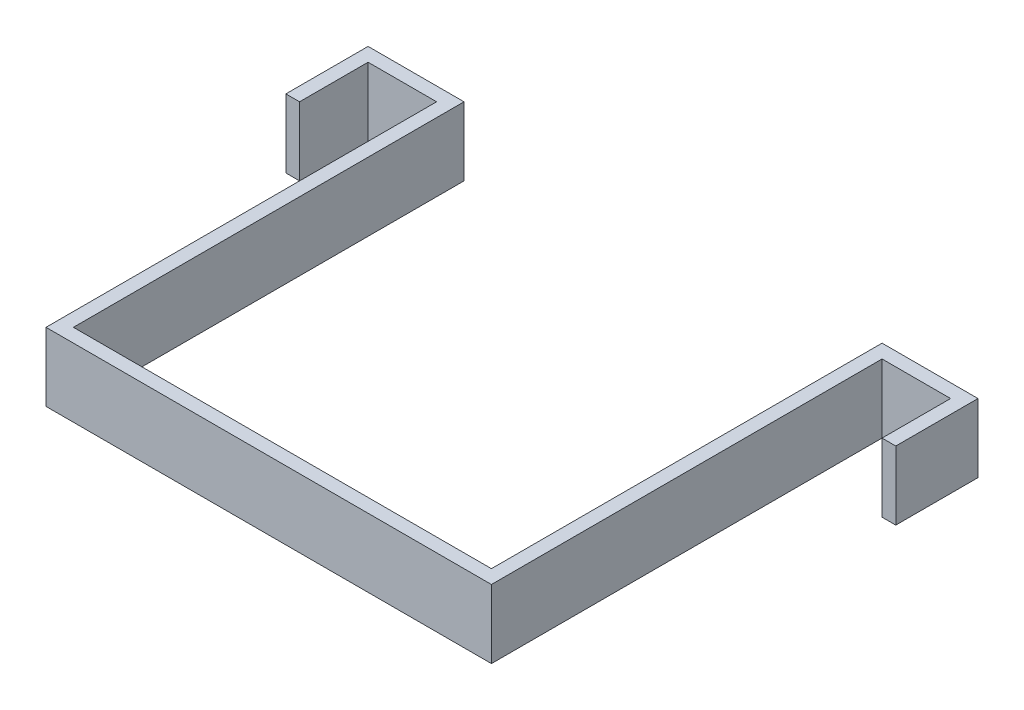
from build123d import *

# Parameters (mm, degrees)
BOSS_EXTRUDE1_DEPTH = 12.7


with BuildPart() as part:
    # Sketch1 → Boss-Extrude1 (new, symmetric)
    with BuildSketch(Plane(origin=(0, 0, 0), x_dir=(1, 0, 0), z_dir=(0, 1, 0))):
        Polygon((-107.95, -25.4), (-107.95, 0), (-82.55, 0), (-82.55, -144.78), (82.55, -144.78), (82.55, 0), (107.95, 0), (107.95, -25.4), (113.03, -25.4), (113.03, 5.08), (77.47, 5.08), (77.47, -139.7), (-77.47, -139.7), (-77.47, 5.08), (-113.03, 5.08), (-113.03, -25.4), align=None)
    extrude(amount=BOSS_EXTRUDE1_DEPTH, both=True)


solid = part.part
